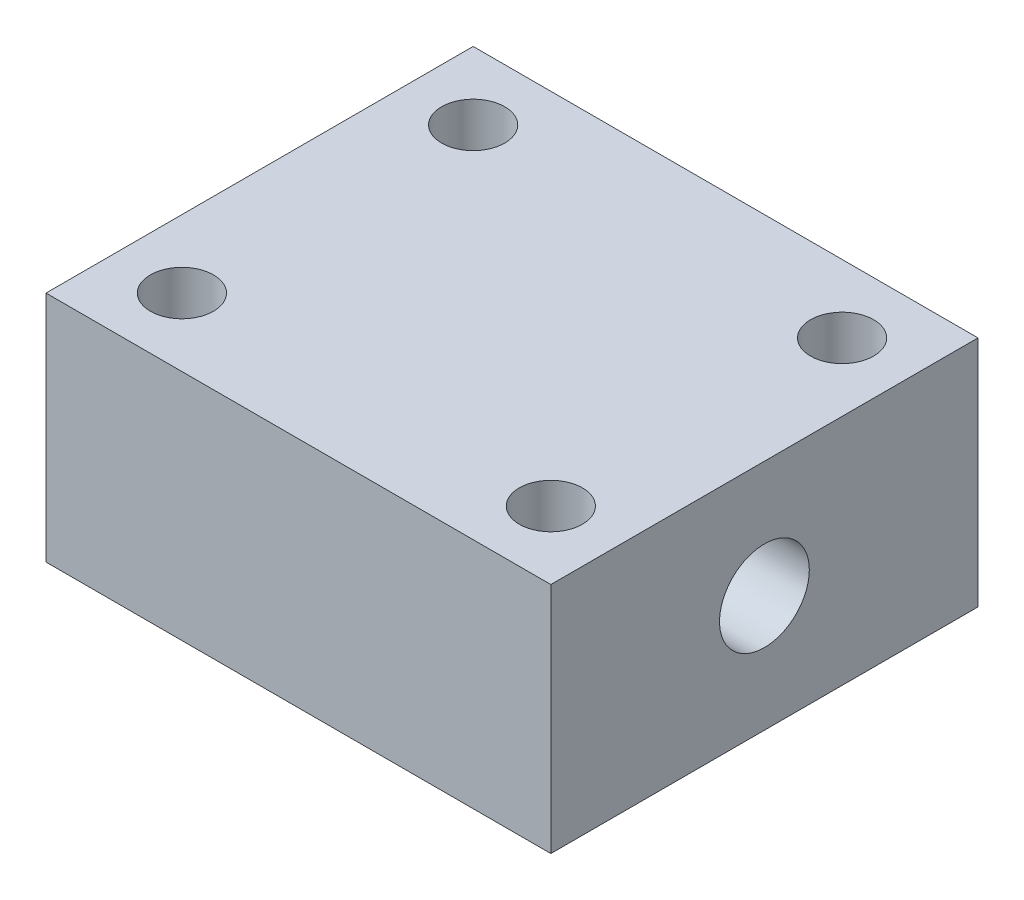
from build123d import *

# Parameters (mm, degrees)
SKETCH1_W           = 82.55
SKETCH1_H           = 69.85
BOSS_EXTRUDE1_DEPTH = 19.05
CUT_EXTRUDE2_START  = -19.05
SKETCH2_R           = 5.159375
CUT_EXTRUDE2_DEPTH  = 77.376117521
CUT_EXTRUDE4_START  = -19.05
SKETCH3_R           = 7.3421875
CUT_EXTRUDE4_DEPTH  = 28.575
CUT_EXTRUDE6_START  = -19.05
SKETCH4_R           = 12.7254
CUT_EXTRUDE6_DEPTH  = 2.8194
CUT_EXTRUDE8_START  = 41.275
SKETCH5_R           = 7.3421875
CUT_EXTRUDE8_DEPTH  = 60.325


with BuildPart() as part:
    # Sketch1 → Boss-Extrude1 (new, symmetric)
    with BuildSketch(Plane(origin=(0, 0, 0), x_dir=(1, 0, 0), z_dir=(0, 1, 0))):
        Rectangle(SKETCH1_W, SKETCH1_H)
    extrude(amount=BOSS_EXTRUDE1_DEPTH, both=True)

    # Sketch2 → Cut-Extrude2 (cut, through all)
    with BuildSketch(Plane(origin=(0, 0, 0), x_dir=(1, 0, 0), z_dir=(0, 1, 0)).offset(CUT_EXTRUDE2_START)):
        with Locations(Location((-30.1625, -23.8125, 0), (0, 0, 270))):
            Circle(SKETCH2_R)
        with Locations(Location((30.1625, -23.8125, 0), (0, 0, 270))):
            Circle(SKETCH2_R)
        with Locations(Location((-30.1625, 23.8125, 0), (0, 0, 270))):
            Circle(SKETCH2_R)
        with Locations(Location((30.1625, 23.8125, 0), (0, 0, 270))):
            Circle(SKETCH2_R)
    extrude(amount=CUT_EXTRUDE2_DEPTH, mode=Mode.SUBTRACT)

    # Sketch3 → Cut-Extrude4 (cut)
    with BuildSketch(Plane(origin=(0, 0, 0), x_dir=(1, 0, 0), z_dir=(0, 1, 0)).offset(CUT_EXTRUDE4_START)):
        with Locations(Location((-17.4625, 0, 0), (0, 0, 270))):
            Circle(SKETCH3_R)
        with Locations(Location((17.4625, 0, 0), (0, 0, 270))):
            Circle(SKETCH3_R)
    extrude(amount=CUT_EXTRUDE4_DEPTH, mode=Mode.SUBTRACT)

    # Sketch4 → Cut-Extrude6 (cut)
    with BuildSketch(Plane(origin=(0, 0, 0), x_dir=(1, 0, 0), z_dir=(0, 1, 0)).offset(CUT_EXTRUDE6_START)):
        with Locations(Location((-17.4625, 0, 0), (0, 0, 270))):
            Circle(SKETCH4_R)
        with Locations(Location((17.4625, 0, 0), (0, 0, 270))):
            Circle(SKETCH4_R)
    extrude(amount=CUT_EXTRUDE6_DEPTH, mode=Mode.SUBTRACT)

    # Sketch5 → Cut-Extrude8 (cut)
    with BuildSketch(Plane(origin=(0, 0, 0), x_dir=(0, 0, -1), z_dir=(1, 0, 0)).offset(CUT_EXTRUDE8_START)):
        Circle(SKETCH5_R)
    extrude(amount=-CUT_EXTRUDE8_DEPTH, mode=Mode.SUBTRACT)


solid = part.part
